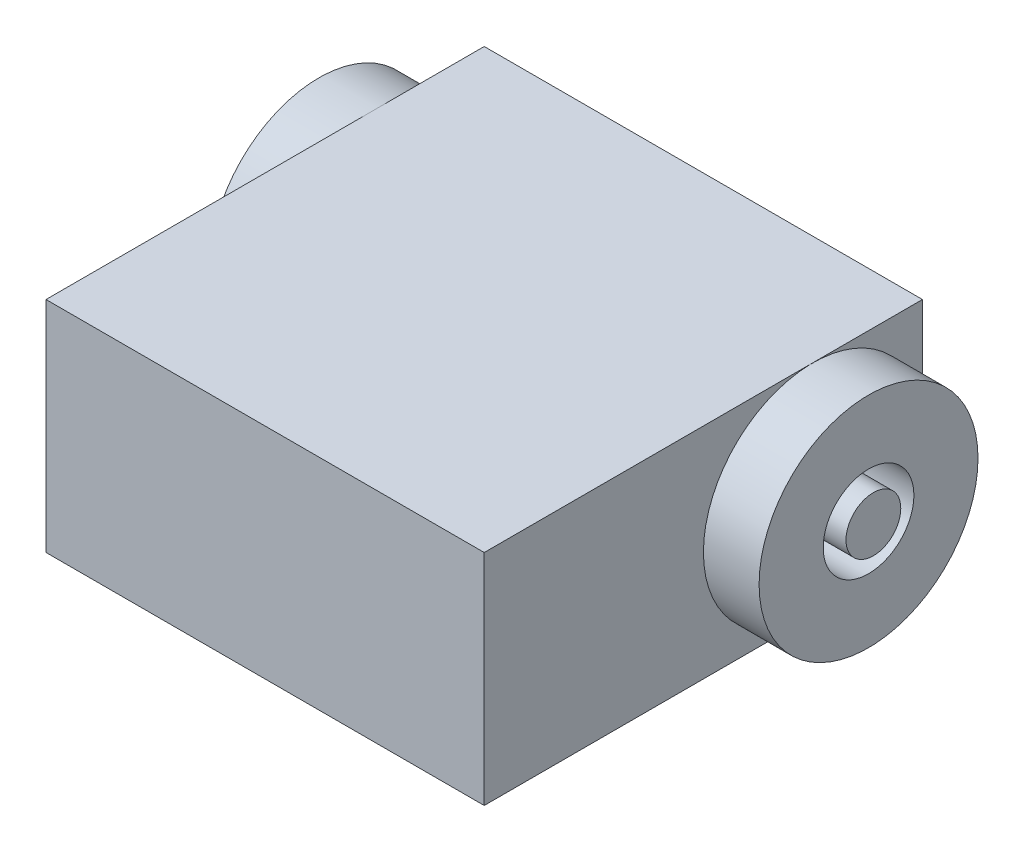
from build123d import *

# Parameters (mm, degrees)
SKETCH1_W           = 40
SKETCH1_H           = 40
BOSS_EXTRUDE1_DEPTH = 20
SKETCH2_R           = 2.5
BOSS_EXTRUDE2_DEPTH = 5.522
SKETCH5_R           = 9.990957645
SKETCH5_R_2         = 4.140871972
BOSS_EXTRUDE5_DEPTH = 5.08


with BuildPart() as part:
    # Sketch1 → Boss-Extrude1 (new body)
    with BuildSketch(Plane(origin=(0, 0, 0), x_dir=(1, 0, 0), z_dir=(0, 1, 0))):
        Rectangle(SKETCH1_W, SKETCH1_H)
    extrude(amount=BOSS_EXTRUDE1_DEPTH)

    # Sketch2 → Boss-Extrude2 (add)
    with BuildSketch(Plane(origin=(20, 0, 0), x_dir=(0, 0, -1), z_dir=(1, 0, 0))):
        with Locations((10, 10)):
            Circle(SKETCH2_R)
    boss_extrude2 = extrude(amount=BOSS_EXTRUDE2_DEPTH)

    # Mirror1: Boss-Extrude2 across plane
    add(boss_extrude2.mirror(Plane(origin=(0, 0, 0), x_dir=(0, 0, 1), z_dir=(1, 0, 0))))

    # Sketch5 → Boss-Extrude5 (add)
    with BuildSketch(Plane(origin=(20, 0, 0), x_dir=(0, 0, -1), z_dir=(1, 0, 0))):
        with Locations((10, 10)):
            Circle(SKETCH5_R)
        with Locations((10, 10)):
            Circle(SKETCH5_R_2, mode=Mode.SUBTRACT)
    boss_extrude5 = extrude(amount=BOSS_EXTRUDE5_DEPTH)

    # Mirror2: Boss-Extrude5 across plane
    add(boss_extrude5.mirror(Plane(origin=(0, 0, 0), x_dir=(0, 0, 1), z_dir=(1, 0, 0))))


solid = part.part
